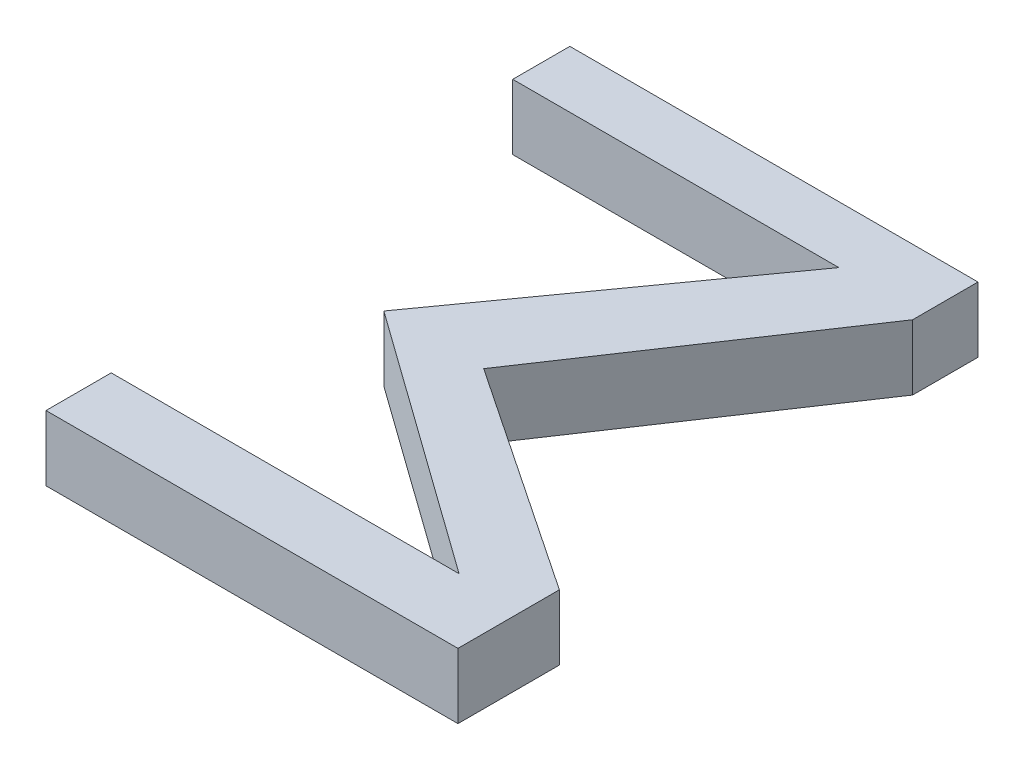
from build123d import *

# Parameters (mm, degrees)
BOSS_EXTRUDE1_DEPTH = 3


with BuildPart() as part:
    # Sketch1 → Boss-Extrude1 (new body)
    with BuildSketch(Plane(origin=(0, 0, 0), x_dir=(1, 0, 0), z_dir=(0, 1, 0))):
        Polygon((-6.264909238, 12.194186704), (8.735090762, 12.194186704), (0, 0), (12.194186704, -8.735090762), (-3.805813296, -8.735090762), (-3.805813296, -11.735090762), (15.14354067, -11.735090762), (15.14354067, -7.070018992), (4.593301435, 0), (12.510340003, 11.814204603), (12.510340003, 14.820574163), (-6.264909238, 14.820574163), align=None)
    extrude(amount=BOSS_EXTRUDE1_DEPTH)


solid = part.part
